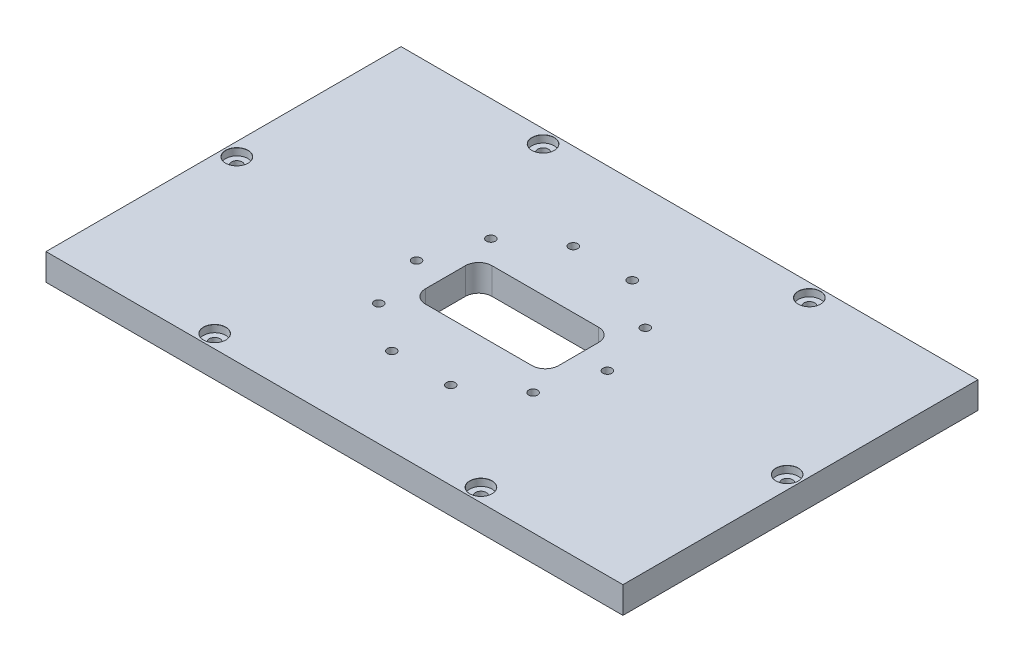
from build123d import *

# Parameters (mm, degrees)
SKIZZE1_W                                    = 130
SKIZZE1_H                                    = 80
AUFSATZ_LINEAR_AUSTRAGEN1_DEPTH              = 6
F_2_4_2_4_DURCHMESSER_BOHRUNG1_D             = 2.4
F_2_4_2_4_DURCHMESSER_BOHRUNG1_DEPTH         = 10
F_2_4_2_4_DURCHMESSER_BOHRUNG1_CSINK_D       = 2.45
F_2_4_2_4_DURCHMESSER_BOHRUNG1_CSINK_ANGLE   = 90
F_2_4_2_4_DURCHMESSER_BOHRUNG1_TIP           = 0.721032743
STIRNSENKUNG_F_R_M2_FLACHKOPFSCHRAUB_2_COUNT = 2
STIRNSENKUNG_F_R_M2_FLACHKOPFSCHRAUB_2_PITCH = 48.918299235
STIRNSENKUNG_F_R_M2_FLACHKOPFSCHRAUB_3_COUNT = 2
STIRNSENKUNG_F_R_M2_FLACHKOPFSCHRAUB_3_PITCH = 74
STIRNSENKUNG_F_R_M2_FLACHKOPFSCHRAUB_4_COUNT = 2
STIRNSENKUNG_F_R_M2_FLACHKOPFSCHRAUB_4_PITCH = 95.268042911
STIRNSENKUNG_F_R_M2_FLACHKOPFSCHRAUB_5_COUNT = 2
STIRNSENKUNG_F_R_M2_FLACHKOPFSCHRAUB_5_PITCH = 99.161484458
STIRNSENKUNG_F_R_M2_FLACHKOPFSCHRAUB_6_COUNT = 2
STIRNSENKUNG_F_R_M2_FLACHKOPFSCHRAUB_6_PITCH = 60
SKIZZE8_R                                    = 1
SKIZZE8_W                                    = 30
SKIZZE8_H                                    = 15
SCHNITT_LINEAR_AUSTRAGEN1_DEPTH              = 6
VERRUNDUNG1_R                                = 3


with BuildPart() as part:
    # Skizze1 → Aufsatz-Linear austragen1 (new body)
    with BuildSketch(Plane(origin=(0, 0, 0), x_dir=(1, 0, 0), z_dir=(0, 1, 0))):
        with Locations((65, 40)):
            Rectangle(SKIZZE1_W, SKIZZE1_H)
    extrude(amount=AUFSATZ_LINEAR_AUSTRAGEN1_DEPTH)

    # Ø2.4 (2.4) Durchmesser Bohrung1
    with Locations(Plane(origin=(0, 6, 0), x_dir=(1, 0, 0), z_dir=(0, 1, 0))):
        with Locations((35, 77), (95, 77), (127, 40), (95, 3), (35, 3), (3, 40), (133.088689194, 32.803420387)):
            CounterSinkHole(F_2_4_2_4_DURCHMESSER_BOHRUNG1_D / 2, F_2_4_2_4_DURCHMESSER_BOHRUNG1_CSINK_D / 2, depth=F_2_4_2_4_DURCHMESSER_BOHRUNG1_DEPTH, counter_sink_angle=F_2_4_2_4_DURCHMESSER_BOHRUNG1_CSINK_ANGLE)
            with Locations((0, 0, -(F_2_4_2_4_DURCHMESSER_BOHRUNG1_DEPTH + F_2_4_2_4_DURCHMESSER_BOHRUNG1_TIP / 2))):  # 118° drill point
                Cone(0, F_2_4_2_4_DURCHMESSER_BOHRUNG1_D / 2, F_2_4_2_4_DURCHMESSER_BOHRUNG1_TIP, mode=Mode.SUBTRACT)

    # Skizze7 → Stirnsenkung für M2 Flachkopfschraube mit Schlitz1 (revolve, cut)
    with BuildSketch(Plane(origin=(95, 6, -3), x_dir=(0, 0, 1), z_dir=(1, 0, 0))):
        Polygon((0, 0), (0, 2.721032743), (1.2, 2), (1.2, 1.6), (2.5, 1.6), (2.5, 0.025), (2.525, 0), align=None)
    stirnsenkung_f_r_m2_flachkopfschraube_mi = revolve(axis=Axis((95, 12.35, -3), (0, -1, 0)), mode=Mode.SUBTRACT)

    # Stirnsenkung f_r M2 Flachkopfschraub 2: Stirnsenkung für M2 Flachkopfschraube mit Schlitz1 ×2
    with Locations(*[Vector(0.6541519329315842, 0, -0.7563631724521444) * (i * STIRNSENKUNG_F_R_M2_FLACHKOPFSCHRAUB_2_PITCH) for i in range(1, STIRNSENKUNG_F_R_M2_FLACHKOPFSCHRAUB_2_COUNT)]):
        add(stirnsenkung_f_r_m2_flachkopfschraube_mi, mode=Mode.SUBTRACT)

    # Stirnsenkung f_r M2 Flachkopfschraub 3: Stirnsenkung für M2 Flachkopfschraube mit Schlitz1 ×2
    with Locations(*[(0, 0, -i * STIRNSENKUNG_F_R_M2_FLACHKOPFSCHRAUB_3_PITCH) for i in range(1, STIRNSENKUNG_F_R_M2_FLACHKOPFSCHRAUB_3_COUNT)]):
        add(stirnsenkung_f_r_m2_flachkopfschraube_mi, mode=Mode.SUBTRACT)

    # Stirnsenkung f_r M2 Flachkopfschraub 4: Stirnsenkung für M2 Flachkopfschraube mit Schlitz1 ×2
    with Locations(*[Vector(-0.6298019584212194, 0, -0.7767557487195037) * (i * STIRNSENKUNG_F_R_M2_FLACHKOPFSCHRAUB_4_PITCH) for i in range(1, STIRNSENKUNG_F_R_M2_FLACHKOPFSCHRAUB_4_COUNT)]):
        add(stirnsenkung_f_r_m2_flachkopfschraube_mi, mode=Mode.SUBTRACT)

    # Stirnsenkung f_r M2 Flachkopfschraub 5: Stirnsenkung für M2 Flachkopfschraube mit Schlitz1 ×2
    with Locations(*[Vector(-0.9277795759357077, 0, -0.37312874249588235) * (i * STIRNSENKUNG_F_R_M2_FLACHKOPFSCHRAUB_5_PITCH) for i in range(1, STIRNSENKUNG_F_R_M2_FLACHKOPFSCHRAUB_5_COUNT)]):
        add(stirnsenkung_f_r_m2_flachkopfschraube_mi, mode=Mode.SUBTRACT)

    # Stirnsenkung f_r M2 Flachkopfschraub 6: Stirnsenkung für M2 Flachkopfschraube mit Schlitz1 ×2
    with Locations(*[(-i * STIRNSENKUNG_F_R_M2_FLACHKOPFSCHRAUB_6_PITCH, 0, 0) for i in range(1, STIRNSENKUNG_F_R_M2_FLACHKOPFSCHRAUB_6_COUNT)]):
        add(stirnsenkung_f_r_m2_flachkopfschraube_mi, mode=Mode.SUBTRACT)

    # Skizze8 → Schnitt-Linear austragen1 (cut)
    with BuildSketch(Plane(origin=(0, 6, 0), x_dir=(1, 0, 0), z_dir=(0, 1, 0))):
        with Locations(Location((47.606134621, 52.637382924, 0), (0, 0, 270))):
            Circle(SKIZZE8_R)
        with Locations(Location((58.356134621, 60.4477151, 0), (0, 0, 270))):
            Circle(SKIZZE8_R)
        with Locations(Location((71.643865379, 60.4477151, 0), (0, 0, 270))):
            Circle(SKIZZE8_R)
        with Locations(Location((82.393865379, 52.637382924, 0), (0, 0, 270))):
            Circle(SKIZZE8_R)
        with Locations(Location((86.5, 40, 0), (0, 0, 270))):
            Circle(SKIZZE8_R)
        with Locations(Location((82.393865379, 27.362617076, 0), (0, 0, 270))):
            Circle(SKIZZE8_R)
        with Locations(Location((71.643865379, 19.5522849, 0), (0, 0, 270))):
            Circle(SKIZZE8_R)
        with Locations(Location((58.356134621, 19.5522849, 0), (0, 0, 270))):
            Circle(SKIZZE8_R)
        with Locations(Location((47.606134621, 27.362617076, 0), (0, 0, 270))):
            Circle(SKIZZE8_R)
        with Locations(Location((43.5, 40, 0), (0, 0, 270))):
            Circle(SKIZZE8_R)
        with Locations((65, 40)):
            Rectangle(SKIZZE8_W, SKIZZE8_H)
    extrude(amount=-SCHNITT_LINEAR_AUSTRAGEN1_DEPTH, mode=Mode.SUBTRACT)

    # Verrundung1
    verrundung1_edges = [part.edges().sort_by_distance(p)[0] for p in [
        (50, 3, -47.5),
        (50, 3, -32.5),
        (80, 3, -32.5),
        (80, 3, -47.5),
    ]]
    fillet(verrundung1_edges, radius=VERRUNDUNG1_R)


solid = part.part
